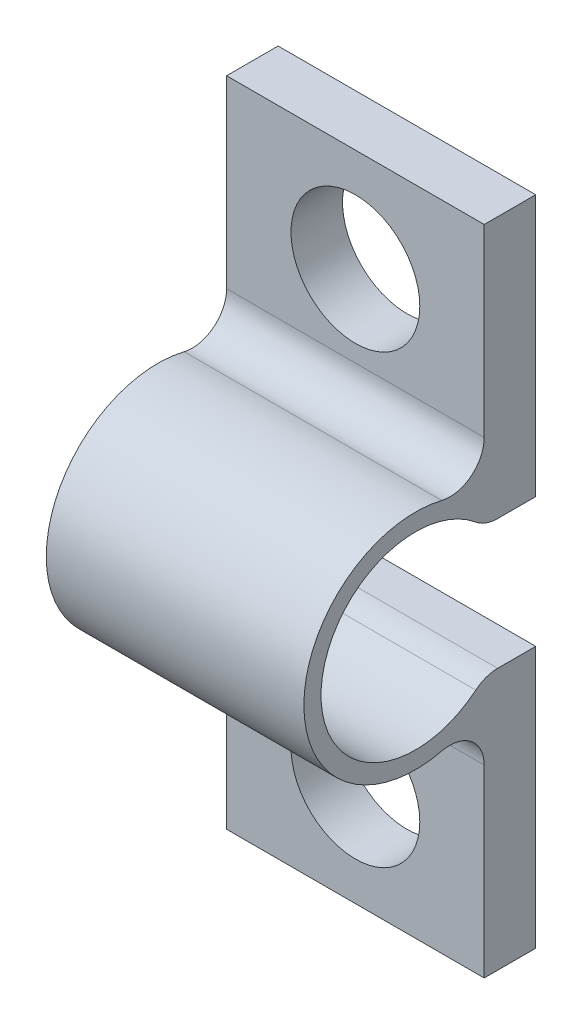
from build123d import *

# Parameters (mm, degrees)
SKETCH1_R           = 3.75
BOSS_EXTRUDE1_DEPTH = 3
SKETCH8_R           = 6.5
SKETCH8_R_2         = 5.5
BOSS_EXTRUDE4_DEPTH = 15
SKETCH9_W           = 15
SKETCH9_H           = 7.549834436
CUT_EXTRUDE5_DEPTH  = 15
FILLET3_R           = 2
FILLET4_R           = 2


with BuildPart() as part:
    # Sketch1 → Boss-Extrude1 (new body)
    with BuildSketch(Plane.XY):
        Polygon((-35.5, -19), (-20.5, -19), (-20.5, 13), (-20.5, 19), (-35.5, 19), align=None)
        with Locations((-28, 13)):
            Circle(SKETCH1_R, mode=Mode.SUBTRACT)
        with Locations((-28, -13)):
            Circle(SKETCH1_R, mode=Mode.SUBTRACT)
    extrude(amount=BOSS_EXTRUDE1_DEPTH)

    # Sketch8 → Boss-Extrude4 (add)
    with BuildSketch(Plane.ZY.offset(35.5)):
        with Locations((7, 0)):
            Circle(SKETCH8_R)
        with Locations((7, 0)):
            Circle(SKETCH8_R_2, mode=Mode.SUBTRACT)
    extrude(amount=-BOSS_EXTRUDE4_DEPTH)

    # Sketch9 → Cut-Extrude5 (cut)
    with BuildSketch(Plane.XY.offset(3)):
        with Locations((-28, 0)):
            Rectangle(SKETCH9_W, SKETCH9_H)
    extrude(amount=-CUT_EXTRUDE5_DEPTH, mode=Mode.SUBTRACT)

    # Fillet3
    fillet3_edges = [part.edges().sort_by_distance(p)[0] for p in [
        (-28, -5.123475383, 3),
        (-28, 5.123475383, 3),
    ]]
    fillet(fillet3_edges, radius=FILLET3_R)

    # Fillet4
    fillet4_edges = [part.edges().sort_by_distance(p)[0] for p in [
        (-28, -3.774917218, 3),
        (-28, 3.774917218, 3),
    ]]
    fillet(fillet4_edges, radius=FILLET4_R)


solid = part.part
